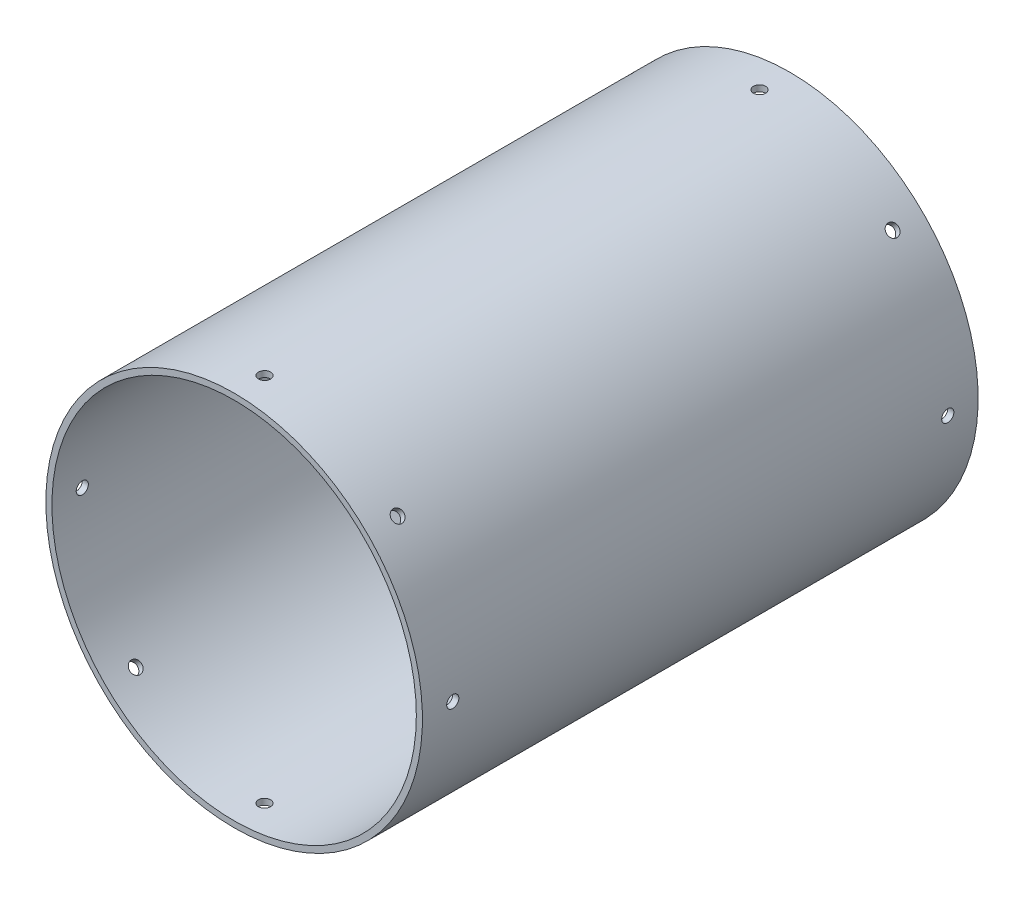
from build123d import *

# Parameters (mm, degrees)
SKETCH1_R           = 31
SKETCH1_R_2         = 30
EXTRUDE_THIN1_DEPTH = 91.5
SKETCH4_R           = 1
CUT_EXTRUDE1_DEPTH  = 102.460583479
CIRPATTERN1_COUNT   = 4
CIRPATTERN1_ANGLE   = 135
CUT_EXTRUDE3_DEPTH  = 102.460583631
CUT_EXTRUDE4_DEPTH  = 102.460583631


with BuildPart() as part:
    # Sketch1 → Extrude-Thin1 (new body)
    with BuildSketch(Plane(origin=(0, 0, 0), x_dir=(0, 1, 0), z_dir=(0, 0, 1))):
        Circle(SKETCH1_R)
        Circle(SKETCH1_R_2, mode=Mode.SUBTRACT)
    extrude(amount=EXTRUDE_THIN1_DEPTH)

    # Sketch4 → Cut-Extrude1 (cut, symmetric)
    with BuildSketch(Plane.YZ):
        with Locations(Location((0, 5, 0), (0, 0, 270))):
            Circle(SKETCH4_R)
        with Locations(Location((0, 86.5, 0), (0, 0, 270))):
            Circle(SKETCH4_R)
    cut_extrude1 = extrude(amount=CUT_EXTRUDE1_DEPTH, both=True, mode=Mode.SUBTRACT)

    # CirPattern1: Cut-Extrude1 ×4 about axis
    cirpattern1_axis = Axis((0, 0, 91.5), (0, 0, -1))
    for i in range(1, CIRPATTERN1_COUNT):
        add(cut_extrude1.rotate(cirpattern1_axis, i * CIRPATTERN1_ANGLE / (CIRPATTERN1_COUNT - 1)), mode=Mode.SUBTRACT)

    # Sketch6 → Cut-Extrude3 (cut, through all)
    with BuildSketch(Plane.YZ):
        with BuildLine():
            Line((-3.5, 39.25), (3.5, 39.25))
            ThreePointArc((3.5, 39.25), (6.5, 36.25), (3.5, 33.25))
            Line((3.5, 33.25), (-3.5, 33.25))
            ThreePointArc((-3.5, 33.25), (-6.5, 36.25), (-3.5, 39.25))
        make_face()
    extrude(amount=-CUT_EXTRUDE3_DEPTH, mode=Mode.SUBTRACT)

    # Sketch7 → Cut-Extrude4 (cut, through all)
    with BuildSketch(Plane(origin=(0, 0, 0), x_dir=(-1, 0, 0), z_dir=(0, 1, 0))):
        with BuildLine():
            Line((-15, 47.5), (0, 47.5))
            ThreePointArc((0, 47.5), (5, 42.5), (0, 37.5))
            Line((0, 37.5), (-15, 37.5))
            ThreePointArc((-15, 37.5), (-20, 42.5), (-15, 47.5))
        make_face()
    extrude(amount=-CUT_EXTRUDE4_DEPTH, mode=Mode.SUBTRACT)


solid = part.part
